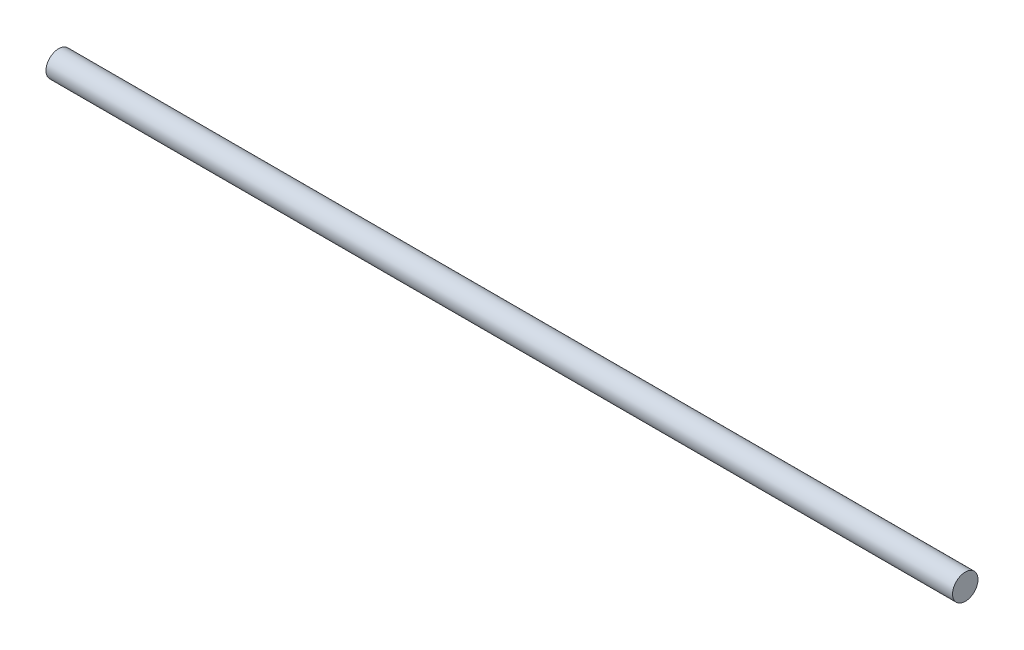
from build123d import *

# Parameters (mm, degrees)
SKETCH_1_R      = 4
EXTRUDE_1_DEPTH = 285


with BuildPart() as part:
    # 草图1 → 凸台-拉伸1 (new body)
    with BuildSketch(Plane(origin=(0, 0, 0), x_dir=(0, 0, -1), z_dir=(1, 0, 0))):
        Circle(SKETCH_1_R)
    extrude(amount=EXTRUDE_1_DEPTH)


solid = part.part
